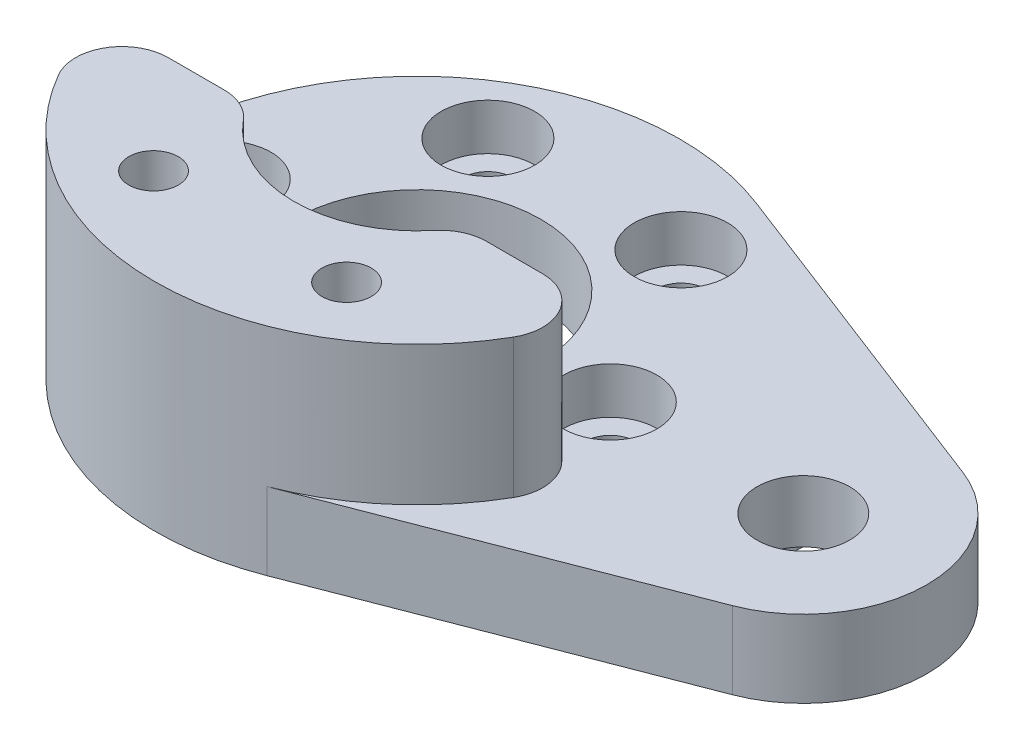
from build123d import *

# Parameters (mm, degrees)
EXTRUDE_1_DEPTH             = 5
EXTRUDE_2_DEPTH             = 9
CUT_EXTRUDE_1_DEPTH         = 1
HOLE_WIZARD_3_0_3_1_D       = 3
HOLE_WIZARD_3_0_3_1_DEPTH   = 3.5
HOLE_WIZARD_3_0_3_1_TIP     = 0.901290929
HOLE_WIZARD_3_0_3_2_D       = 3
HOLE_WIZARD_3_0_3_2_DEPTH   = 3.5
HOLE_WIZARD_3_0_3_2_TIP     = 0.901290929
HOLE_WIZARD_M31_D           = 3.2
HOLE_WIZARD_M31_CBORE_D     = 6.05
HOLE_WIZARD_M31_CBORE_DEPTH = 3
HOLE_WIZARD_16_0_16_1_D     = 16
HOLE_WIZARD_16_0_16_1_DEPTH = 14
HOLE_WIZARD_3_2_3_2_1_D     = 3.2
HOLE_WIZARD_6_0_6_1_D       = 6
HOLE_WIZARD_6_0_6_1_DEPTH   = 13
FILLET_1_R                  = 2
FILLET_2_R                  = 3


with BuildPart() as part:
    # Эскиз1 → Бобышка-Вытянуть1 (new body)
    with BuildSketch(Plane.XZ):
        with BuildLine():
            Line((6.12, -15.860189154), (27.88, -7.463618425))
            ThreePointArc((27.88, -7.463618425), (33, 0), (27.88, 7.463618425))
            Line((27.88, 7.463618425), (6.12, 15.860189154))
            ThreePointArc((6.12, 15.860189154), (-17, 0), (6.12, -15.860189154))
        make_face()
    extrude(amount=-EXTRUDE_1_DEPTH)

    # Эскиз2 → Бобышка-Вытянуть2 (add)
    with BuildSketch(Plane(origin=(0, 5, 0), x_dir=(-1, 0, 0), z_dir=(0, 1, 0))):
        with BuildLine():
            Line((12.124355653, 4), (-12.124355653, 4))
            ThreePointArc((-12.124355653, 4), (-14.722431864, 5.5), (-14.722431864, 8.5))
            ThreePointArc((-14.722431864, 8.5), (0, 17), (14.722431864, 8.5))
            ThreePointArc((14.722431864, 8.5), (14.722431864, 5.5), (12.124355653, 4))
        make_face()
    extrude(amount=EXTRUDE_2_DEPTH)

    # Эскиз3 → Вырез-Вытянуть1 (cut)
    with BuildSketch(Plane.XZ):
        with BuildLine():
            Line((21.85, 3.882975663), (21.85, -3.882975663))
            ThreePointArc((21.85, -3.882975663), (25, -5), (28.15, -3.882975663))
            Line((28.15, -3.882975663), (28.15, 3.882975663))
            ThreePointArc((28.15, 3.882975663), (25, 5), (21.85, 3.882975663))
        make_face()
    extrude(amount=-CUT_EXTRUDE_1_DEPTH, mode=Mode.SUBTRACT)

    # Диаметр отверстия Ø3.0 (3)1
    with Locations(Plane(origin=(0, 0, 0), x_dir=(-1, 0, 0), z_dir=(0, -1, 0))):
        with Locations((0, 12.5)):
            Hole(HOLE_WIZARD_3_0_3_1_D / 2, depth=HOLE_WIZARD_3_0_3_1_DEPTH)
            with Locations((0, 0, -(HOLE_WIZARD_3_0_3_1_DEPTH + HOLE_WIZARD_3_0_3_1_TIP / 2))):  # 118° drill point
                Cone(0, HOLE_WIZARD_3_0_3_1_D / 2, HOLE_WIZARD_3_0_3_1_TIP, mode=Mode.SUBTRACT)

    # Диаметр отверстия Ø3.0 (3)2
    with Locations(Plane(origin=(0, 0, 0), x_dir=(-1, 0, 0), z_dir=(0, -1, 0))):
        with Locations((0, -12.5)):
            Hole(HOLE_WIZARD_3_0_3_2_D / 2, depth=HOLE_WIZARD_3_0_3_2_DEPTH)
            with Locations((0, 0, -(HOLE_WIZARD_3_0_3_2_DEPTH + HOLE_WIZARD_3_0_3_2_TIP / 2))):  # 118° drill point
                Cone(0, HOLE_WIZARD_3_0_3_2_D / 2, HOLE_WIZARD_3_0_3_2_TIP, mode=Mode.SUBTRACT)

    # Цековка для винта с заклепочной головкой M31 (through all)
    with Locations(Plane(origin=(0, 5, 0), x_dir=(1, 0, 0), z_dir=(0, 1, 0))):
        with Locations((12.5, 0), (6.25, 10.825317547), (-6.25, 10.825317547), (-12.5, 0)):
            CounterBoreHole(HOLE_WIZARD_M31_D / 2, HOLE_WIZARD_M31_CBORE_D / 2, HOLE_WIZARD_M31_CBORE_DEPTH)

    # Диаметр отверстия Ø16.0 (16)1
    with Locations(Plane(origin=(0, 0, 0), x_dir=(-1, 0, 0), z_dir=(0, -1, 0))):
        with Locations((0, 0)):
            Hole(HOLE_WIZARD_16_0_16_1_D / 2, depth=HOLE_WIZARD_16_0_16_1_DEPTH)

    # Диаметр отверстия Ø3.2 (3.2)1 (through all)
    with Locations(Plane(origin=(0, 0, 0), x_dir=(-1, 0, 0), z_dir=(0, -1, 0))):
        with Locations((6.25, -10.825317547), (-6.25, -10.825317547)):
            Hole(HOLE_WIZARD_3_2_3_2_1_D / 2)

    # Диаметр отверстия Ø6.0 (6)1
    with Locations(Plane(origin=(0, 1, 0), x_dir=(-1, 0, 0), z_dir=(0, -1, 0))):
        with Locations((-25, 0)):
            Hole(HOLE_WIZARD_6_0_6_1_D / 2, depth=HOLE_WIZARD_6_0_6_1_DEPTH)

    # Скругление1
    fillet_1_edges = [part.edges().sort_by_distance(p)[0] for p in [
        (21.85, 0.5, 3.882975663),
        (28.15, 0.5, 3.882975663),
        (28.15, 0.5, -3.882975663),
        (21.85, 0.5, -3.882975663),
    ]]
    fillet(fillet_1_edges, radius=FILLET_1_R)

    # Скругление2
    fillet_2_edges = [part.edges().sort_by_distance(p)[0] for p in [
        (6.92820323, 9.5, 4),
        (-6.92820323, 9.5, 4),
    ]]
    fillet(fillet_2_edges, radius=FILLET_2_R)


solid = part.part
